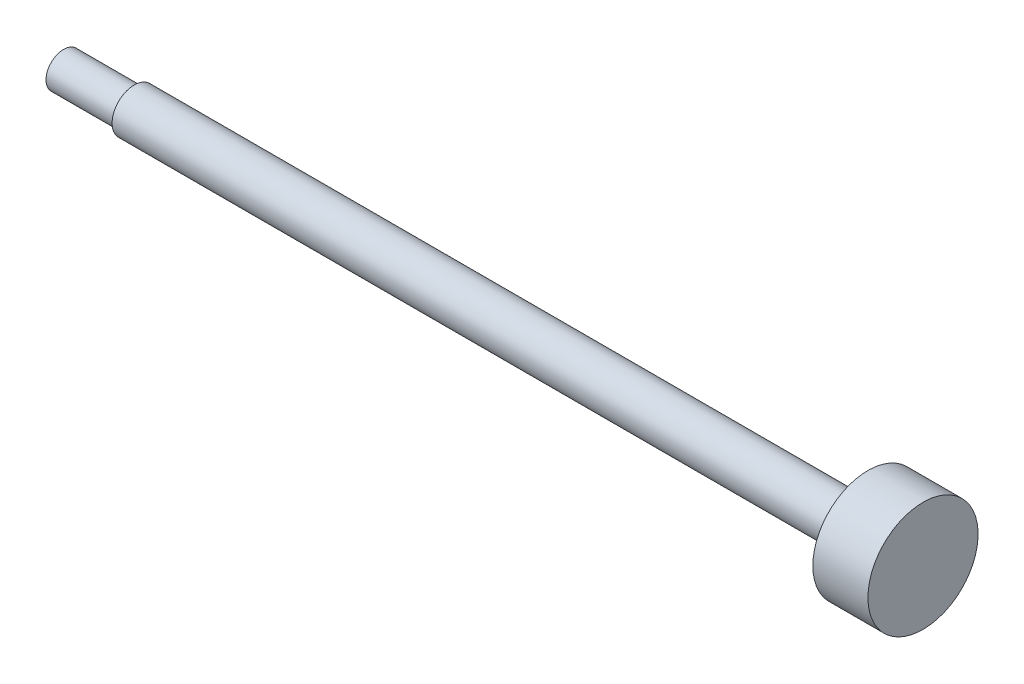
from build123d import *


with BuildPart() as part:
    # Esquisse1 → Révolution1 (revolve)
    with BuildSketch(Plane.XY, mode=Mode.PRIVATE) as r_volution1_sk:
        Polygon((0, 0), (0, 8), (32, 8), (32, 10), (365, 10), (365, 25), (390, 25), (390, 0), align=None)
    revolve(r_volution1_sk.sketch.rotate(Axis((0, 0, 0), (1, 0, 0)), 90), axis=Axis((0, 0, 0), (1, 0, 0)))


solid = part.part
